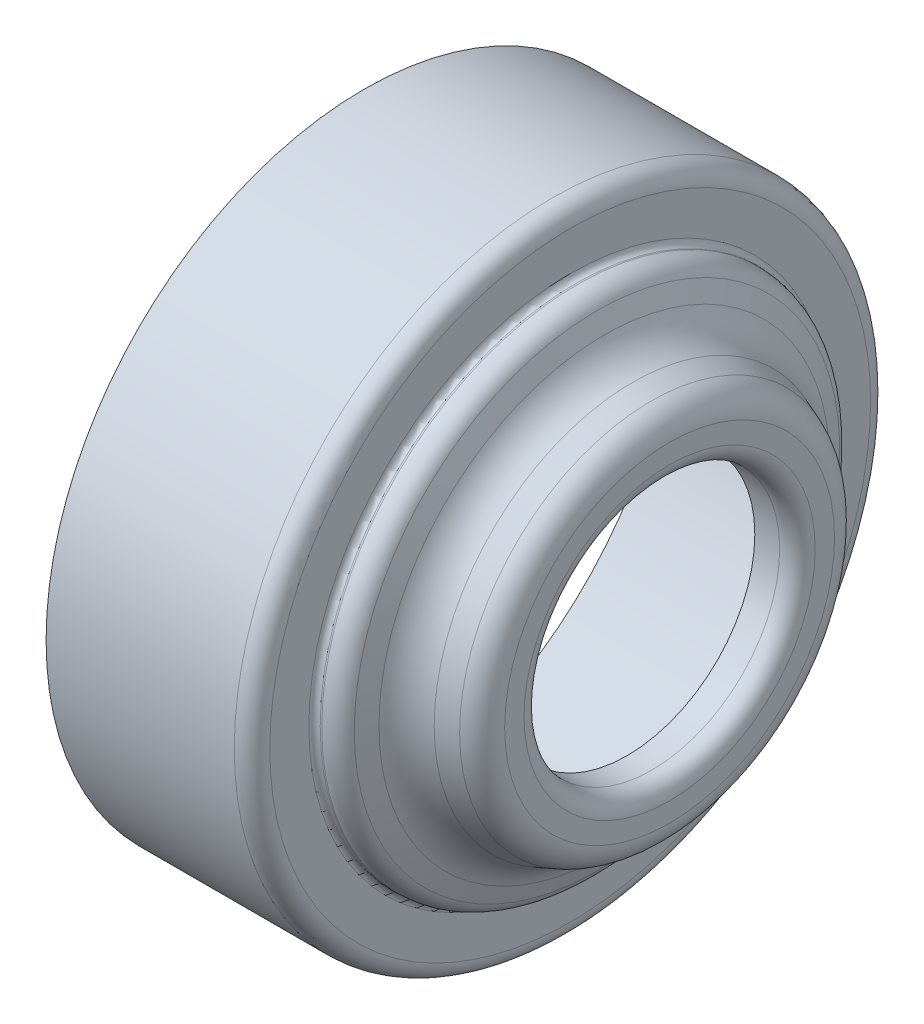
from build123d import *


with BuildPart() as part:
    # 草图1 → 旋转1 (revolve)
    with BuildSketch(Plane.XY, mode=Mode.PRIVATE) as revolve_1_sk:
        with BuildLine():
            Line((-14.5, 22.4), (-1.25, 22.4))
            ThreePointArc((-1.25, 22.4), (-0.366116524, 22.033883476), (0, 21.15))
            Line((0, 21.15), (0, 18.4))
            ThreePointArc((0, 18.4), (0.117157288, 18.117157288), (0.4, 18))
            Line((0.4, 18), (0.510905763, 18))
            ThreePointArc((0.510905763, 18), (1.336642276, 17.752261638), (1.889623308, 17.090878948))
            Line((1.889623308, 17.090878948), (2.411281919, 15.873675522))
            ThreePointArc((2.411281919, 15.873675522), (3.211140728, 14.721110448), (4.399357479, 13.975240946))
            Line((4.399357479, 13.975240946), (5.702246883, 13.486657419))
            ThreePointArc((5.702246883, 13.486657419), (6.643851235, 12.753188739), (7, 11.613999064))
            Line((7, 11.613999064), (7, 10.25))
            ThreePointArc((7, 10.25), (6.633883476, 9.366116524), (5.75, 9))
            Line((5.75, 9), (4, 9))
            Line((4, 9), (4, 9.4))
            Line((4, 9.4), (5.75, 9.4))
            ThreePointArc((5.75, 9.4), (6.351040764, 9.648959236), (6.6, 10.25))
            Line((6.6, 10.25), (6.6, 11.613999064))
            ThreePointArc((6.6, 11.613999064), (6.315080988, 12.525350804), (5.561797507, 13.112125748))
            Line((5.561797507, 13.112125748), (4.258908102, 13.600709274))
            ThreePointArc((4.258908102, 13.600709274), (2.934895151, 14.431821006), (2.043623907, 15.716107803))
            Line((2.043623907, 15.716107803), (1.521965296, 16.933311228))
            ThreePointArc((1.521965296, 16.933311228), (1.116445873, 17.418325201), (0.510905763, 17.6))
            Line((0.510905763, 17.6), (0.4, 17.6))
            ThreePointArc((0.4, 17.6), (-0.165685425, 17.834314575), (-0.4, 18.4))
            Line((-0.4, 18.4), (-0.4, 21.15))
            ThreePointArc((-0.4, 21.15), (-0.648959236, 21.751040764), (-1.25, 22))
            Line((-1.25, 22), (-14.5, 22))
            Line((-14.5, 22), (-14.5, 22.4))
        make_face()
    revolve(revolve_1_sk.sketch.rotate(Axis((-28.972485425, 0, 0), (1, 0, 0)), 90), axis=Axis((-28.972485425, 0, 0), (1, 0, 0)))


solid = part.part
